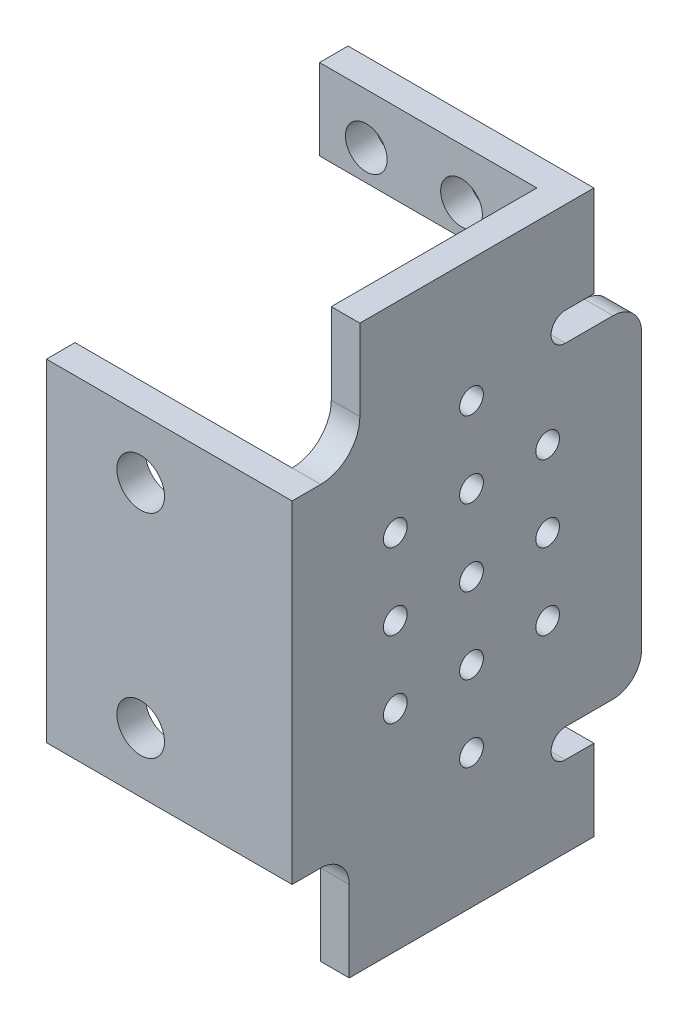
from build123d import *

# Parameters (mm, degrees)
ESQUISSE1_R             = 2.19
BOSS_EXTRU_2_DEPTH      = 3
ESQUISSE1_W             = 22.82
ESQUISSE1_H             = 8.5
BOSS_EXTRU_2_2_DEPTH    = 3
BOSS_EXTRU_4_DEPTH      = 3
CONG_1_R                = 3
ESQUISSE4_W             = 3
ESQUISSE4_H             = 9.614426754
BOSS_EXTRU_5_DEPTH      = 5
ENL_V_MAT_EXTRU_1_DEPTH = 5
ESQUISSE15_W            = 3
ESQUISSE15_H            = 34.885573246
BOSS_EXTRU_6_DEPTH      = 22.8
ESQUISSE17_R            = 1.25
ENL_V_MAT_EXTRU_2_DEPTH = 4
ESQUISSE19_R            = 2.5
ENL_V_MAT_EXTRU_5_DEPTH = 4


with BuildPart() as part:
    # Esquisse1 → Boss.-Extru.2 (new body)
    with BuildSketch(Plane.XY):
        Polygon((-22.134709342, 12.031312967), (-22.134709342, 3.531312967), (-2.314709342, 3.531312967), (-2.314709342, 2.416886213), (0.685290658, 2.416886213), (0.685290658, 12.031312967), align=None)
        with Locations((-17.224709342, 6.731312967)):
            Circle(ESQUISSE1_R, mode=Mode.SUBTRACT)
        with Locations((-7.224709342, 6.731312967)):
            Circle(ESQUISSE1_R, mode=Mode.SUBTRACT)
    extrude(amount=BOSS_EXTRU_2_DEPTH)



with BuildPart() as body_2:
    # Esquisse1 → Boss.-Extru.2 2 (new body)
    with BuildSketch(Plane.XY):
        with Locations((-10.724709342, -42.718687033)):
            Rectangle(ESQUISSE1_W, ESQUISSE1_H)
        with Locations((-17.224709342, -41.668687033)):
            Circle(ESQUISSE1_R, mode=Mode.SUBTRACT)
        with Locations((-7.224709342, -41.668687033)):
            Circle(ESQUISSE1_R, mode=Mode.SUBTRACT)
    extrude(amount=BOSS_EXTRU_2_2_DEPTH)

    # Esquisse3 → Boss.-Extru.4 (add)
    with BuildSketch(Plane(origin=(0.685290658, 0, 0), x_dir=(0, 0, -1), z_dir=(1, 0, 0))):
        with BuildLine():
            Line((0, 2.416886213), (0, 12.031312967))
            Line((0, 12.031312967), (-31.7, 12.031312967))
            Line((-31.7, 12.031312967), (-31.7, -46.968687033))
            Line((-31.7, -46.968687033), (0, -46.968687033))
            Line((0, -46.968687033), (0, -38.468687033))
            Line((0, -38.468687033), (-3, -38.468687033))
            ThreePointArc((-3, -38.468687033), (-4.5, -36.968687033), (-3, -35.468687033))
            Line((-3, -35.468687033), (5, -35.468687033))
            Line((5, -35.468687033), (5, -0.583113787))
            Line((5, -0.583113787), (-3, -0.583113787))
            ThreePointArc((-3, -0.583113787), (-4.5, 0.916886213), (-3, 2.416886213))
            Line((-3, 2.416886213), (0, 2.416886213))
        make_face()
    extrude(amount=BOSS_EXTRU_4_DEPTH)

    # Congé1
    cong_1_edges = [body_2.edges().sort_by_distance(p)[0] for p in [
        (2.185290658, -35.468687033, -5),
        (2.185290658, -0.583113787, -5),
    ]]
    fillet(cong_1_edges, radius=CONG_1_R)


with BuildPart() as part_1:
    add(part.part)

    add(body_2.part)  # Boss.-Extru.5 merges body 2
    # Esquisse4 → Boss.-Extru.5 (add)
    with BuildSketch(Plane(origin=(3.685290658, 0, 0), x_dir=(0, 0, -1), z_dir=(1, 0, 0))):
        with Locations((-1.5, 7.22409959)):
            Rectangle(ESQUISSE4_W, ESQUISSE4_H)
    extrude(amount=-BOSS_EXTRU_5_DEPTH)

    # Esquisse13 → Enlèv. mat.-Extru.1 (cut)
    with BuildSketch(Plane.ZY.offset(-0.685290658)):
        Polygon((28.7, -0.583113787), (31.7, -0.583113787), (31.7, 12.031312967), (24.585573245, 12.031312967), (24.585573245, 3.531312967), (28.7, 3.531312967), align=None)
        with BuildLine():
            ThreePointArc((28.7, -0.583113787), (25.790660941, 0.621973908), (24.585573245, 3.531312967))
            Line((24.585573245, 3.531312967), (28.7, 3.531312967))
            Line((28.7, 3.531312967), (28.7, -0.583113787))
        make_face()
        Polygon((31.7, -46.968687033), (31.7, -35.468687033), (28.7, -35.468687033), (28.7, -38.468687033), (25.7, -38.468687033), (25.7, -46.968687033), align=None)
        with BuildLine():
            ThreePointArc((25.7, -38.468687033), (26.578679656, -36.347366689), (28.7, -35.468687033))
            Line((28.7, -35.468687033), (28.7, -38.468687033))
            Line((28.7, -38.468687033), (25.7, -38.468687033))
        make_face()
    extrude(amount=-ENL_V_MAT_EXTRU_1_DEPTH, mode=Mode.SUBTRACT)

    # Esquisse15 → Boss.-Extru.6 (add)
    with BuildSketch(Plane.ZY.offset(-0.685290658)):
        with Locations((30.2, -18.02590041)):
            Rectangle(ESQUISSE15_W, ESQUISSE15_H)
    extrude(amount=BOSS_EXTRU_6_DEPTH)

    # Esquisse17 → Enlèv. mat.-Extru.2 (cut)
    with BuildSketch(Plane(origin=(3.685290658, 0, 0), x_dir=(0, 0, -1), z_dir=(1, 0, 0))):
        with Locations((-20.861566887, -16.89090041)):
            Circle(ESQUISSE17_R)
        with Locations((-20.861566887, -24.89090041)):
            Circle(ESQUISSE17_R)
        with Locations((-12.861566887, -24.89090041)):
            Circle(ESQUISSE17_R)
        with Locations((-4.861566887, -24.89090041)):
            Circle(ESQUISSE17_R)
        with Locations((-4.861566887, -16.89090041)):
            Circle(ESQUISSE17_R)
        with Locations((-4.861566887, -8.89090041)):
            Circle(ESQUISSE17_R)
        with Locations((-12.861566887, -8.89090041)):
            Circle(ESQUISSE17_R)
        with Locations((-20.861566887, -8.89090041)):
            Circle(ESQUISSE17_R)
        with Locations((-12.861566887, -0.89090041)):
            Circle(ESQUISSE17_R)
        with Locations((-12.861566887, -32.89090041)):
            Circle(ESQUISSE17_R)
        with Locations((-12.861566887, -16.89090041)):
            Circle(ESQUISSE17_R)
    extrude(amount=-ENL_V_MAT_EXTRU_2_DEPTH, mode=Mode.SUBTRACT)

    # Esquisse19 → Enlèv. mat.-Extru.5 (cut)
    with BuildSketch(Plane.XY.offset(31.7)):
        with Locations((-12.214709342, -6.873113787)):
            Circle(ESQUISSE19_R)
        with Locations((-12.214709342, -29.178687033)):
            Circle(ESQUISSE19_R)
    extrude(amount=-ENL_V_MAT_EXTRU_5_DEPTH, mode=Mode.SUBTRACT)


solid = part_1.part
